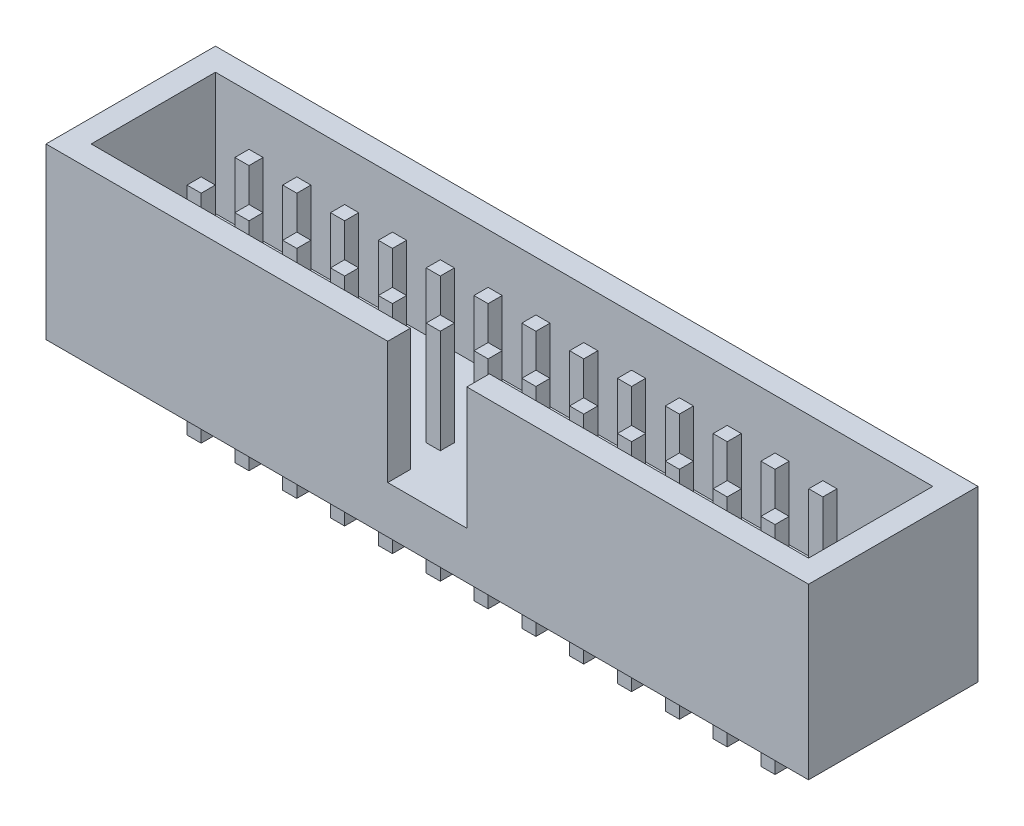
from build123d import *

# Parameters (mm, degrees)
SKETCH_1_W           = 40.5
SKETCH_1_H           = 9
EXTRUDE_1_DEPTH      = 9
SKETCH_2_W           = 38.1
SKETCH_2_H           = 6.6
CUT_EXTRUDE_1_DEPTH  = 6.5
SKETCH_3_W           = 4.2
SKETCH_3_H           = 6.5
CUT_EXTRUDE_2_DEPTH  = 6.5
EXTRUDE_2_DEPTH      = 3.5
EXTRUDE_2_DEPTH_BACK = 8
SKETCH_5_W           = 0.75
SKETCH_5_H           = 0.75


with BuildPart() as part:
    # 草图1 → 拉伸1 (new body)
    with BuildSketch(Plane(origin=(0, 0, 0), x_dir=(1, 0, 0), z_dir=(0, 1, 0))):
        Rectangle(SKETCH_1_W, SKETCH_1_H)
    extrude(amount=EXTRUDE_1_DEPTH)

    # 草图2 → 切除-拉伸1 (cut)
    with BuildSketch(Plane(origin=(0, 9, 0), x_dir=(-1, 0, 0), z_dir=(0, 1, 0))):
        Rectangle(SKETCH_2_W, SKETCH_2_H)
    extrude(amount=-CUT_EXTRUDE_1_DEPTH, mode=Mode.SUBTRACT)

    # 草图3 → 切除-拉伸2 (cut)
    with BuildSketch(Plane.XY.offset(4.5)):
        with Locations((0, 5.75)):
            Rectangle(SKETCH_3_W, SKETCH_3_H)
    extrude(amount=-CUT_EXTRUDE_2_DEPTH, mode=Mode.SUBTRACT)

    # 草图5 → 拉伸2 (add, two sides: drawn at the far end of the back side and taken through both)
    with BuildSketch(Plane.XZ.offset(-EXTRUDE_2_DEPTH_BACK)):
        with Locations((0, 1.27)):
            Rectangle(SKETCH_5_W, SKETCH_5_H)
        with Locations((2.54, 1.27)):
            Rectangle(SKETCH_5_W, SKETCH_5_H)
        with Locations((5.08, 1.27)):
            Rectangle(SKETCH_5_W, SKETCH_5_H)
        with Locations((7.62, 1.27)):
            Rectangle(SKETCH_5_W, SKETCH_5_H)
        with Locations((10.16, 1.27)):
            Rectangle(SKETCH_5_W, SKETCH_5_H)
        with Locations((12.7, 1.27)):
            Rectangle(SKETCH_5_W, SKETCH_5_H)
        with Locations((15.24, 1.27)):
            Rectangle(SKETCH_5_W, SKETCH_5_H)
        with Locations((-2.54, 1.27)):
            Rectangle(SKETCH_5_W, SKETCH_5_H)
        with Locations((-5.08, 1.27)):
            Rectangle(SKETCH_5_W, SKETCH_5_H)
        with Locations((-7.62, 1.27)):
            Rectangle(SKETCH_5_W, SKETCH_5_H)
        with Locations((-10.16, 1.27)):
            Rectangle(SKETCH_5_W, SKETCH_5_H)
        with Locations((-12.7, 1.27)):
            Rectangle(SKETCH_5_W, SKETCH_5_H)
        with Locations((-15.24, 1.27)):
            Rectangle(SKETCH_5_W, SKETCH_5_H)
        with Locations((-15.24, -1.27)):
            Rectangle(SKETCH_5_W, SKETCH_5_H)
        with Locations((-12.7, -1.27)):
            Rectangle(SKETCH_5_W, SKETCH_5_H)
        with Locations((-10.16, -1.27)):
            Rectangle(SKETCH_5_W, SKETCH_5_H)
        with Locations((-7.62, -1.27)):
            Rectangle(SKETCH_5_W, SKETCH_5_H)
        with Locations((-5.08, -1.27)):
            Rectangle(SKETCH_5_W, SKETCH_5_H)
        with Locations((-2.54, -1.27)):
            Rectangle(SKETCH_5_W, SKETCH_5_H)
        with Locations((15.24, -1.27)):
            Rectangle(SKETCH_5_W, SKETCH_5_H)
        with Locations((12.7, -1.27)):
            Rectangle(SKETCH_5_W, SKETCH_5_H)
        with Locations((10.16, -1.27)):
            Rectangle(SKETCH_5_W, SKETCH_5_H)
        with Locations((7.62, -1.27)):
            Rectangle(SKETCH_5_W, SKETCH_5_H)
        with Locations((5.08, -1.27)):
            Rectangle(SKETCH_5_W, SKETCH_5_H)
        with Locations((2.54, -1.27)):
            Rectangle(SKETCH_5_W, SKETCH_5_H)
        with Locations((0, -1.27)):
            Rectangle(SKETCH_5_W, SKETCH_5_H)
    extrude(amount=EXTRUDE_2_DEPTH + EXTRUDE_2_DEPTH_BACK)


solid = part.part
